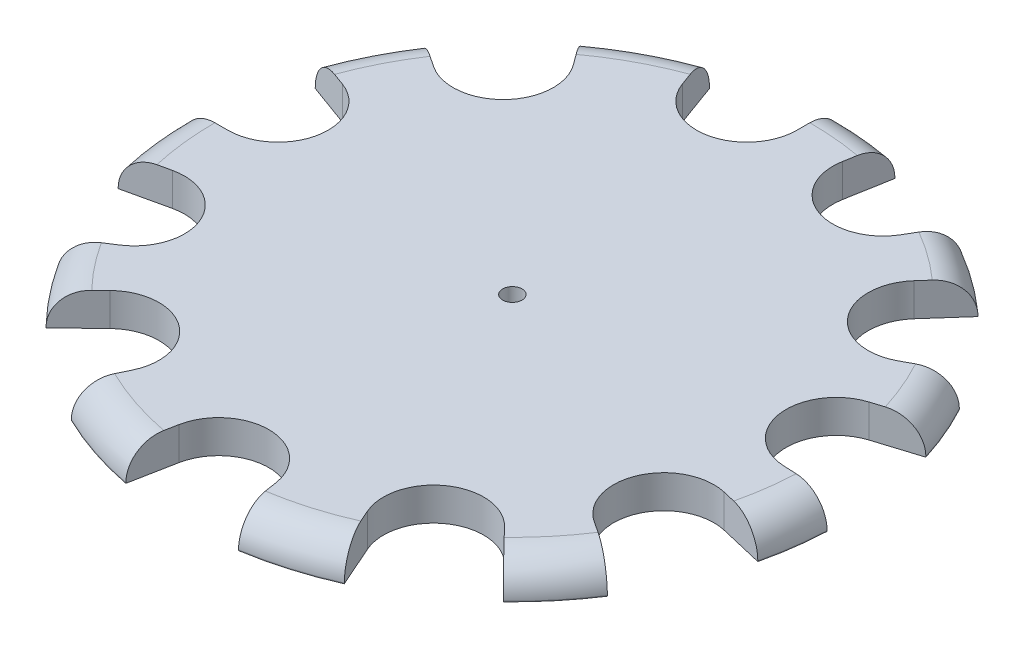
from build123d import *

# Parameters (mm, degrees)
SKETCH1_R           = 51
BOSS_EXTRUDE1_DEPTH = 5.1
CUT_EXTRUDE1_DEPTH  = 5.1
SKETCH4_R           = 1.5
CUT_EXTRUDE2_DEPTH  = 5.1
FILLET1_R           = 5


with BuildPart() as part:
    # Sketch1 → Boss-Extrude1 (new body)
    with BuildSketch(Plane(origin=(0, 0, 0), x_dir=(1, 0, 0), z_dir=(0, 1, 0))):
        Circle(SKETCH1_R)
    extrude(amount=BOSS_EXTRUDE1_DEPTH)

    # Sketch2 → Cut-Extrude1 (cut)
    with BuildSketch(Plane(origin=(0, 5.1, 0), x_dir=(1, 0, 0), z_dir=(0, 1, 0))):
        with BuildLine():
            Line((-9.688125222, -50.071351387), (-8.358382544, -43.198812961))
            ThreePointArc((-8.358382544, -43.198812961), (-0.656441916, -36.914485182), (6.906677195, -43.365213388))
            Line((6.906677195, -43.365213388), (8.021550998, -50.365213388))
            ThreePointArc((8.021550998, -50.365213388), (-1.00839266, -60.771067516), (-9.688125222, -50.071351387))
        make_face()
        with BuildLine():
            Line((20.649792342, -46.632457326), (17.815507119, -40.231923967))
            ThreePointArc((17.815507119, -40.231923967), (20.583994852, -30.649859604), (30.501228977, -31.712379774))
            Line((30.501228977, -31.712379774), (35.353697223, -36.757531102))
            ThreePointArc((35.353697223, -36.757531102), (33.885984185, -50.456709947), (20.649792342, -46.632457326))
        make_face()
        with BuildLine():
            Line((42.649130762, -27.965186308), (36.795328501, -24.126827403))
            ThreePointArc((36.795328501, -24.126827403), (33.921361466, -14.575869584), (42.828159638, -10.087058146))
            Line((42.828159638, -10.087058146), (49.641730489, -11.691817397))
            ThreePointArc((49.641730489, -11.691817397), (55.842353557, -23.995229776), (42.649130762, -27.965186308))
        make_face()
        with BuildLine():
            Line((50.948811436, -2.284428442), (43.955837317, -1.97087944))
            ThreePointArc((43.955837317, -1.97087944), (36.610159411, 4.776082682), (41.979056436, 13.181760913))
            Line((41.979056436, 13.181760913), (48.657542687, 15.27885924))
            ThreePointArc((48.657542687, 15.27885924), (60.268732657, 7.862529281), (50.948811436, -2.284428442))
        make_face()
        with BuildLine():
            Line((33.859367399, 38.138474528), (29.212003246, 32.903781946))
            ThreePointArc((29.212003246, 32.903781946), (28.933740385, 22.933674045), (38.704060106, 20.928347554))
            Line((38.704060106, 20.928347554), (44.861524214, 24.257857392))
            ThreePointArc((44.861524214, 24.257857392), (47.631583476, 37.754095915), (33.859367399, 38.138474528))
        make_face()
        with BuildLine():
            Line((25.570223533, 44.126677515), (22.060585009, 38.070074719))
            ThreePointArc((22.060585009, 38.070074719), (12.682685538, 34.673682028), (7.709436531, 43.319332732))
            Line((7.709436531, 43.319332732), (8.935937797, 50.211044758))
            ThreePointArc((8.935937797, 50.211044758), (20.878613925, 57.080846029), (25.570223533, 44.126677515))
        make_face()
        with BuildLine():
            Line((0, 51), (0, 44))
            ThreePointArc((0, 44), (-6.411157361, 36.359480183), (-15.048886306, 41.346475315))
            Line((-15.048886306, 41.346475315), (-17.44302731, 47.92432366))
            ThreePointArc((-17.44302731, 47.92432366), (-10.554237819, 59.856057061), (0, 51))
        make_face()
        with BuildLine():
            Line((-42.422624234, 28.307612988), (-36.599911104, 24.422254342))
            ThreePointArc((-36.599911104, 24.422254342), (-26.685882427, 25.514278688), (-26.039763455, 35.46731903))
            Line((-26.039763455, 35.46731903), (-30.182453096, 41.109847058))
            ThreePointArc((-30.182453096, 41.109847058), (-43.931092888, 42.002363987), (-42.422624234, 28.307612988))
        make_face()
        with BuildLine():
            Line((-47.92432366, 17.44302731), (-41.346475315, 15.048886306))
            ThreePointArc((-41.346475315, 15.048886306), (-36.359480183, 6.411157361), (-44, 0))
            Line((-44, 0), (-51, 0))
            ThreePointArc((-51, 0), (-59.856057061, 10.554237819), (-47.92432366, 17.44302731))
        make_face()
        with BuildLine():
            Line((-49.754001296, -11.204434614), (-42.925020726, -9.666571039))
            ThreePointArc((-42.925020726, -9.666571039), (-34.06267119, -14.242512744), (-37.030163211, -23.764827215))
            Line((-37.030163211, -23.764827215), (-42.92132554, -27.545595181))
            ThreePointArc((-42.92132554, -27.545595181), (-56.074981825, -23.446447837), (-49.754001296, -11.204434614))
        make_face()
        with BuildLine():
            Line((-36.68381982, -35.430175887), (-31.648785727, -30.567210569))
            ThreePointArc((-31.648785727, -30.567210569), (-21.699140919, -29.870755284), (-19.285528665, -39.54830444))
            Line((-19.285528665, -39.54830444), (-22.353680953, -45.840080147))
            ThreePointArc((-22.353680953, -45.840080147), (-35.721770787, -49.174125256), (-36.68381982, -35.430175887))
        make_face()
    extrude(amount=-CUT_EXTRUDE1_DEPTH, mode=Mode.SUBTRACT)

    # Sketch4 → Cut-Extrude2 (cut)
    with BuildSketch(Plane(origin=(0, 5.1, 0), x_dir=(1, 0, 0), z_dir=(0, 1, 0))):
        Circle(SKETCH4_R)
    extrude(amount=-CUT_EXTRUDE2_DEPTH, mode=Mode.SUBTRACT)

    # Fillet1
    fillet1_edges = [part.edges().sort_by_distance(p)[0] for p in [
        (4.485349337, 5.1, -50.802378304),
        (29.865259304, 5.1, -41.340854934),
        (46.974563015, 5.1, -19.859265585),
        (50.51474065, 5.1, 7.018616465),
        (39.248396466, 5.1, 32.566292003),
        (-24.055266966, 5.1, -44.970480664),
        (-45.498929152, 5.1, -23.040126867),
        (-50.687543174, 5.1, 5.636751453),
        (14.456654149, 5.1, 48.908129701),
        (-39.997330476, 5.1, 31.64195877),
        (-16.159989165, 5.1, 48.372045131),
    ]]
    fillet(fillet1_edges, radius=FILLET1_R)


solid = part.part
